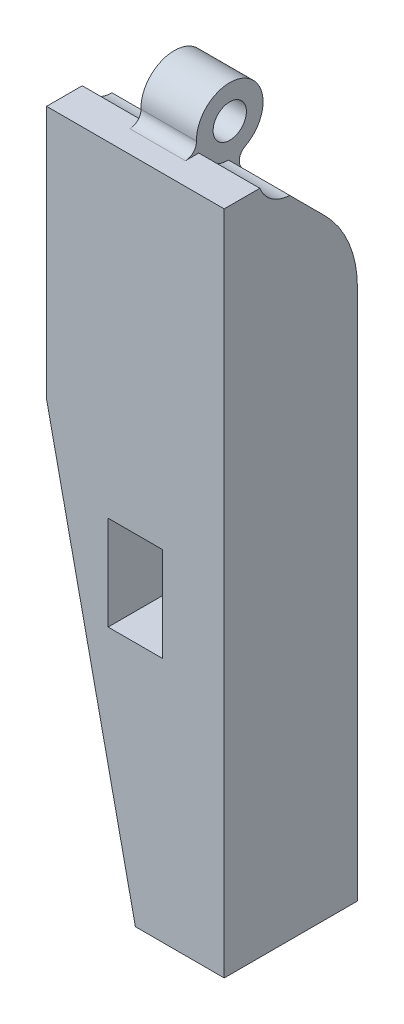
from build123d import *

# Parameters (mm, degrees)
SKETCH1_W               = 16
SKETCH1_H               = 60
BOSS_EXTRUDE1_DEPTH     = 12
CUT_EXTRUDE1_DEPTH      = 62.708994482
CUT_EXTRUDE1_DEPTH_BACK = 62.708994482
CUT_EXTRUDE3_DEPTH      = 62.708994482
CUT_EXTRUDE3_DEPTH_BACK = 62.708994482
SKETCH4_R               = 3
SKETCH4_R_2             = 1.5
BOSS_EXTRUDE2_DEPTH     = 2.5
FILLET1_R               = 1
CUT_EXTRUDE4_DEPTH      = 62.708994482
FILLET2_R               = 10
SKETCH6_W               = 4.913298596
SKETCH6_H               = 8.315277322
SKETCH6_H_2             = 8.493571251
CUT_EXTRUDE5_DEPTH      = 5
SKETCH7_W               = 4.913298596
SKETCH7_H               = 8.493571251
CUT_EXTRUDE6_DEPTH      = 62.708994482
CUT_EXTRUDE7_REACH      = 44.091
SKETCH8_W               = 4.913298596
SKETCH8_H               = 2.5


with BuildPart() as part:
    # Sketch1 → Boss-Extrude1 (new body)
    with BuildSketch(Plane.XY):
        with Locations((0, -30)):
            Rectangle(SKETCH1_W, SKETCH1_H)
    extrude(amount=BOSS_EXTRUDE1_DEPTH)

    # Sketch2 → Cut-Extrude1 (cut, two sides: drawn at the far end of the back side and taken through both)
    with BuildSketch(Plane(origin=(0, 0, 0), x_dir=(0, 0, -1), z_dir=(1, 0, 0)).offset(-CUT_EXTRUDE1_DEPTH_BACK)):
        Polygon((-8, 0), (0, 0), (0, -8), align=None)
    extrude(amount=CUT_EXTRUDE1_DEPTH + CUT_EXTRUDE1_DEPTH_BACK, mode=Mode.SUBTRACT)

    # Sketch3 → Cut-Extrude3 (cut, two sides: drawn at the far end of the back side and taken through both)
    with BuildSketch(Plane(origin=(0, 0, 0), x_dir=(0, 0, -1), z_dir=(1, 0, 0)).offset(-CUT_EXTRUDE3_DEPTH_BACK)):
        with BuildLine():
            ThreePointArc((-3, 1.1), (-6.559834153, 4.04730143), (-8.791057147, 0))
            Line((-8.791057147, 0), (-7.019803903, 0))
            ThreePointArc((-7.019803903, 0), (-6.600122548, 2.474719218), (-4.5, 1.1))
            ThreePointArc((-4.5, 1.1), (-4.625280782, 0.499877452), (-4.980196097, 0))
            Line((-4.980196097, 0), (-3.208942853, 0))
            ThreePointArc((-3.208942853, 0), (-3.05269857, 0.540165847), (-3, 1.1))
        make_face()
        with BuildLine():
            Line((-7.019803903, 0), (-8.791057147, 0))
            ThreePointArc((-8.791057147, 0), (-6, -1.9), (-3.208942853, 0))
            Line((-3.208942853, 0), (-4.980196097, 0))
            ThreePointArc((-4.980196097, 0), (-6, -0.4), (-7.019803903, 0))
        make_face()
    extrude(amount=CUT_EXTRUDE3_DEPTH + CUT_EXTRUDE3_DEPTH_BACK, mode=Mode.SUBTRACT)

    # Sketch4 → Boss-Extrude2 (add, symmetric)
    with BuildSketch(Plane(origin=(0, 0, 0), x_dir=(0, 0, -1), z_dir=(1, 0, 0))):
        with Locations((-6, 1.1)):
            Circle(SKETCH4_R)
        with Locations((-6, 1.1)):
            Circle(SKETCH4_R_2, mode=Mode.SUBTRACT)
    extrude(amount=BOSS_EXTRUDE2_DEPTH, both=True)

    # Fillet1
    fillet1_edges = [part.edges().sort_by_distance(p)[0] for p in [
        (0, -1.898274836, 6.101725164),
        (0, 0, 8.791057147),
    ]]
    fillet(fillet1_edges, radius=FILLET1_R)

    # Sketch5 → Cut-Extrude4 (cut, through all)
    with BuildSketch(Plane(origin=(0, 0, 0), x_dir=(-1, 0, 0), z_dir=(0, 0, -1))):
        Polygon((0, -60), (8, -22.851648758), (8, -60), align=None)
    extrude(amount=-CUT_EXTRUDE4_DEPTH, mode=Mode.SUBTRACT)

    # Fillet2
    fillet2_edges = [part.edges().sort_by_distance(p)[0] for p in [
        (0, -8, 0),
    ]]
    fillet(fillet2_edges, radius=FILLET2_R)

    # Sketch6 → Cut-Extrude5 (cut)
    with BuildSketch(Plane(origin=(0, 0, 0), x_dir=(-1, 0, 0), z_dir=(0, 0, -1))):
        with Locations((0, -16.299774285)):
            Rectangle(SKETCH6_W, SKETCH6_H)
        with Locations((0, -33.604863133)):
            Rectangle(SKETCH6_W, SKETCH6_H_2)
    extrude(amount=-CUT_EXTRUDE5_DEPTH, mode=Mode.SUBTRACT)

    # Sketch7 → Cut-Extrude6 (cut, through all)
    with BuildSketch(Plane(origin=(0, 0, 0), x_dir=(-1, 0, 0), z_dir=(0, 0, -1))):
        with Locations((0, -33.604863133)):
            Rectangle(SKETCH7_W, SKETCH7_H)
    extrude(amount=-CUT_EXTRUDE6_DEPTH, mode=Mode.SUBTRACT)

    # Sketch8 → Cut-Extrude7 (cut, up to next)
    with BuildSketch(Plane(origin=(0, -20.457412946, 0), x_dir=(1, 0, 0), z_dir=(0, 1, 0)), mode=Mode.PRIVATE) as cut_extrude7_sk1:
        with Locations((0, -3.75)):
            Rectangle(SKETCH8_W, SKETCH8_H)
    cut_extrude7_tool1 = extrude(cut_extrude7_sk1.sketch, amount=-CUT_EXTRUDE7_REACH, mode=Mode.PRIVATE) & part.part
    add(cut_extrude7_tool1.solids().sort_by_distance((0, -20.457413, 3.75))[0], mode=Mode.SUBTRACT)


solid = part.part
